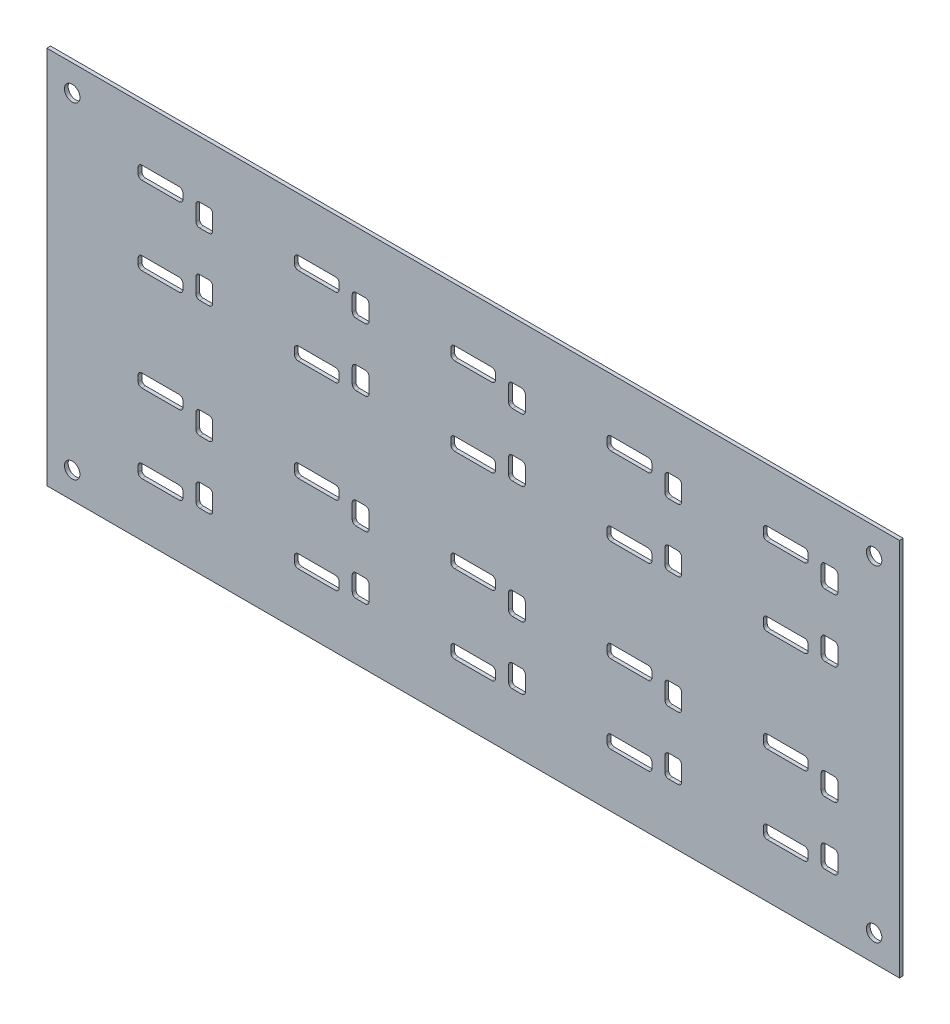
from build123d import *

# Parameters (mm, degrees)
SKETCH1_W                  = 457.2
SKETCH1_H                  = 203.2
BOSS_EXTRUDE1_DEPTH        = 2
SKETCH2_W                  = 24
SKETCH2_H                  = 7
CUT_EXTRUDE1_DEPTH         = 251.16898289
LPATTERN1_COUNT            = 2
LPATTERN1_PITCH            = 42.02811
LPATTERN2_COUNT            = 5
LPATTERN2_PITCH            = 83.82
LPATTERN2_COUNT_DIR2       = 2
LPATTERN2_PITCH_DIR2       = 96.52
LPATTERN2_COPY_1_SKETCH_W  = 24
LPATTERN2_COPY_1_SKETCH_H  = 7
LPATTERN2_COPY_1_DEPTH     = 251.16898289
LPATTERN2_COPY_2_SKETCH_W  = 24
LPATTERN2_COPY_2_SKETCH_H  = 7
LPATTERN2_COPY_2_DEPTH     = 251.16898289
LPATTERN2_COPY_3_SKETCH_W  = 24
LPATTERN2_COPY_3_SKETCH_H  = 7
LPATTERN2_COPY_3_DEPTH     = 251.16898289
LPATTERN2_COPY_4_SKETCH_W  = 24
LPATTERN2_COPY_4_SKETCH_H  = 7
LPATTERN2_COPY_4_DEPTH     = 251.16898289
LPATTERN2_COPY_5_SKETCH_W  = 24
LPATTERN2_COPY_5_SKETCH_H  = 7
LPATTERN2_COPY_5_DEPTH     = 251.16898289
LPATTERN2_COPY_6_SKETCH_W  = 24
LPATTERN2_COPY_6_SKETCH_H  = 7
LPATTERN2_COPY_6_DEPTH     = 251.16898289
LPATTERN2_COPY_7_SKETCH_W  = 24
LPATTERN2_COPY_7_SKETCH_H  = 7
LPATTERN2_COPY_7_DEPTH     = 251.16898289
LPATTERN2_COPY_8_SKETCH_W  = 24
LPATTERN2_COPY_8_SKETCH_H  = 7
LPATTERN2_COPY_8_DEPTH     = 251.16898289
LPATTERN2_COPY_9_SKETCH_W  = 24
LPATTERN2_COPY_9_SKETCH_H  = 7
LPATTERN2_COPY_9_DEPTH     = 251.16898289
FILLET1_R                  = 2
F_8_3_8_3_DIAMETER_HOLE1_D = 8.3
SKETCH5_W                  = 9
SKETCH5_H                  = 12
CUT_EXTRUDE2_DEPTH         = 251.16898289
FILLET2_R                  = 2
LPATTERN3_COUNT            = 5
LPATTERN3_PITCH            = 83.82
LPATTERN3_COUNT_DIR2       = 2
LPATTERN3_PITCH_DIR2       = 96.52
FILLET2_OF_LPATTERN3_R     = 2


with BuildPart() as part:
    # Sketch1 → Boss-Extrude1 (new body)
    with BuildSketch(Plane.XY):
        Rectangle(SKETCH1_W, SKETCH1_H)
    extrude(amount=BOSS_EXTRUDE1_DEPTH)

    # Sketch2 → Cut-Extrude1 (cut, through all)
    with BuildSketch(Plane(origin=(0, 0, 0), x_dir=(-1, 0, 0), z_dir=(0, 0, -1))):
        with Locations((167.6273, -69.27342)):
            Rectangle(SKETCH2_W, SKETCH2_H)
    cut_extrude1 = extrude(amount=-CUT_EXTRUDE1_DEPTH, mode=Mode.SUBTRACT)

    # LPattern1: Cut-Extrude1 ×2
    with Locations(*[(0, i * LPATTERN1_PITCH, 0) for i in range(1, LPATTERN1_COUNT)]):
        add(cut_extrude1, mode=Mode.SUBTRACT)

    # LPattern2: Cut-Extrude1 5 × 2
    with Locations(*[(i * LPATTERN2_PITCH, j * LPATTERN2_PITCH_DIR2, 0) for i in range(LPATTERN2_COUNT) for j in range(LPATTERN2_COUNT_DIR2) if (i, j) != (0, 0)]):
        add(cut_extrude1, mode=Mode.SUBTRACT)

    # LPattern2 copy 1 sketch → LPattern2 copy 1 (cut, through all)
    with BuildSketch(Plane(origin=(0, 138.54811, 0), x_dir=(-1, 0, 0), z_dir=(0, 0, -1))):
        with Locations((167.6273, -69.27342)):
            Rectangle(LPATTERN2_COPY_1_SKETCH_W, LPATTERN2_COPY_1_SKETCH_H)
    extrude(amount=-LPATTERN2_COPY_1_DEPTH, mode=Mode.SUBTRACT)

    # LPattern2 copy 2 sketch → LPattern2 copy 2 (cut, through all)
    with BuildSketch(Plane(origin=(83.82, 42.02811, 0), x_dir=(-1, 0, 0), z_dir=(0, 0, -1))):
        with Locations((167.6273, -69.27342)):
            Rectangle(LPATTERN2_COPY_2_SKETCH_W, LPATTERN2_COPY_2_SKETCH_H)
    extrude(amount=-LPATTERN2_COPY_2_DEPTH, mode=Mode.SUBTRACT)

    # LPattern2 copy 3 sketch → LPattern2 copy 3 (cut, through all)
    with BuildSketch(Plane(origin=(83.82, 138.54811, 0), x_dir=(-1, 0, 0), z_dir=(0, 0, -1))):
        with Locations((167.6273, -69.27342)):
            Rectangle(LPATTERN2_COPY_3_SKETCH_W, LPATTERN2_COPY_3_SKETCH_H)
    extrude(amount=-LPATTERN2_COPY_3_DEPTH, mode=Mode.SUBTRACT)

    # LPattern2 copy 4 sketch → LPattern2 copy 4 (cut, through all)
    with BuildSketch(Plane(origin=(167.64, 42.02811, 0), x_dir=(-1, 0, 0), z_dir=(0, 0, -1))):
        with Locations((167.6273, -69.27342)):
            Rectangle(LPATTERN2_COPY_4_SKETCH_W, LPATTERN2_COPY_4_SKETCH_H)
    extrude(amount=-LPATTERN2_COPY_4_DEPTH, mode=Mode.SUBTRACT)

    # LPattern2 copy 5 sketch → LPattern2 copy 5 (cut, through all)
    with BuildSketch(Plane(origin=(167.64, 138.54811, 0), x_dir=(-1, 0, 0), z_dir=(0, 0, -1))):
        with Locations((167.6273, -69.27342)):
            Rectangle(LPATTERN2_COPY_5_SKETCH_W, LPATTERN2_COPY_5_SKETCH_H)
    extrude(amount=-LPATTERN2_COPY_5_DEPTH, mode=Mode.SUBTRACT)

    # LPattern2 copy 6 sketch → LPattern2 copy 6 (cut, through all)
    with BuildSketch(Plane(origin=(251.46, 42.02811, 0), x_dir=(-1, 0, 0), z_dir=(0, 0, -1))):
        with Locations((167.6273, -69.27342)):
            Rectangle(LPATTERN2_COPY_6_SKETCH_W, LPATTERN2_COPY_6_SKETCH_H)
    extrude(amount=-LPATTERN2_COPY_6_DEPTH, mode=Mode.SUBTRACT)

    # LPattern2 copy 7 sketch → LPattern2 copy 7 (cut, through all)
    with BuildSketch(Plane(origin=(251.46, 138.54811, 0), x_dir=(-1, 0, 0), z_dir=(0, 0, -1))):
        with Locations((167.6273, -69.27342)):
            Rectangle(LPATTERN2_COPY_7_SKETCH_W, LPATTERN2_COPY_7_SKETCH_H)
    extrude(amount=-LPATTERN2_COPY_7_DEPTH, mode=Mode.SUBTRACT)

    # LPattern2 copy 8 sketch → LPattern2 copy 8 (cut, through all)
    with BuildSketch(Plane(origin=(335.28, 42.02811, 0), x_dir=(-1, 0, 0), z_dir=(0, 0, -1))):
        with Locations((167.6273, -69.27342)):
            Rectangle(LPATTERN2_COPY_8_SKETCH_W, LPATTERN2_COPY_8_SKETCH_H)
    extrude(amount=-LPATTERN2_COPY_8_DEPTH, mode=Mode.SUBTRACT)

    # LPattern2 copy 9 sketch → LPattern2 copy 9 (cut, through all)
    with BuildSketch(Plane(origin=(335.28, 138.54811, 0), x_dir=(-1, 0, 0), z_dir=(0, 0, -1))):
        with Locations((167.6273, -69.27342)):
            Rectangle(LPATTERN2_COPY_9_SKETCH_W, LPATTERN2_COPY_9_SKETCH_H)
    extrude(amount=-LPATTERN2_COPY_9_DEPTH, mode=Mode.SUBTRACT)

    # Fillet1
    fillet1_edges = [part.edges().sort_by_distance(p)[0] for p in [
        (-95.8073, 30.74658, 1),
        (-95.8073, 23.74658, 1),
        (-71.8073, 23.74658, 1),
        (-71.8073, 30.74658, 1),
        (-95.8073, 72.77469, 1),
        (-95.8073, 65.77469, 1),
        (-71.8073, 65.77469, 1),
        (-71.8073, 72.77469, 1),
        (-11.9873, -65.77342, 1),
        (-11.9873, -72.77342, 1),
        (12.0127, -72.77342, 1),
        (12.0127, -65.77342, 1),
        (-11.9873, -23.74531, 1),
        (-11.9873, -30.74531, 1),
        (12.0127, -30.74531, 1),
        (12.0127, -23.74531, 1),
        (-11.9873, 30.74658, 1),
        (-11.9873, 23.74658, 1),
        (12.0127, 23.74658, 1),
        (12.0127, 30.74658, 1),
        (-11.9873, 72.77469, 1),
        (-11.9873, 65.77469, 1),
        (12.0127, 65.77469, 1),
        (12.0127, 72.77469, 1),
        (71.8327, -65.77342, 1),
        (71.8327, -72.77342, 1),
        (95.8327, -72.77342, 1),
        (95.8327, -65.77342, 1),
        (-179.6273, -65.77342, 1),
        (71.8327, -23.74531, 1),
        (71.8327, -30.74531, 1),
        (95.8327, -30.74531, 1),
        (95.8327, -23.74531, 1),
        (-179.6273, -72.77342, 1),
        (-155.6273, -72.77342, 1),
        (-155.6273, -65.77342, 1),
        (71.8327, 30.74658, 1),
        (71.8327, 23.74658, 1),
        (95.8327, 23.74658, 1),
        (95.8327, 30.74658, 1),
        (71.8327, 72.77469, 1),
        (71.8327, 65.77469, 1),
        (95.8327, 65.77469, 1),
        (95.8327, 72.77469, 1),
        (155.6527, -65.77342, 1),
        (155.6527, -72.77342, 1),
        (179.6527, -72.77342, 1),
        (179.6527, -65.77342, 1),
        (155.6527, -23.74531, 1),
        (155.6527, -30.74531, 1),
        (179.6527, -30.74531, 1),
        (179.6527, -23.74531, 1),
        (155.6527, 30.74658, 1),
        (155.6527, 23.74658, 1),
        (179.6527, 23.74658, 1),
        (179.6527, 30.74658, 1),
        (155.6527, 72.77469, 1),
        (155.6527, 65.77469, 1),
        (179.6527, 65.77469, 1),
        (179.6527, 72.77469, 1),
        (-179.6273, -23.74531, 1),
        (-179.6273, -30.74531, 1),
        (-155.6273, -30.74531, 1),
        (-155.6273, -23.74531, 1),
        (-179.6273, 30.74658, 1),
        (-179.6273, 23.74658, 1),
        (-155.6273, 23.74658, 1),
        (-155.6273, 30.74658, 1),
        (-179.6273, 72.77469, 1),
        (-179.6273, 65.77469, 1),
        (-155.6273, 65.77469, 1),
        (-155.6273, 72.77469, 1),
        (-95.8073, -65.77342, 1),
        (-95.8073, -72.77342, 1),
        (-71.8073, -72.77342, 1),
        (-71.8073, -65.77342, 1),
        (-95.8073, -23.74531, 1),
        (-95.8073, -30.74531, 1),
        (-71.8073, -30.74531, 1),
        (-71.8073, -23.74531, 1),
    ]]
    fillet(fillet1_edges, radius=FILLET1_R)

    # Ø8.3 (8.3) Diameter Hole1 (through all)
    with Locations(Plane(origin=(0, 0, 0), x_dir=(-1, 0, 0), z_dir=(0, 0, -1))):
        with Locations((-215.000000022, 87.500000006), (-215.000000022, -87.499999994), (214.999999978, -87.499999994), (214.999999978, 87.500000006)):
            Hole(F_8_3_8_3_DIAMETER_HOLE1_D / 2)

    # Sketch5 → Cut-Extrude2 (cut, through all)
    with BuildSketch(Plane(origin=(0, 0, 0), x_dir=(-1, 0, 0), z_dir=(0, 0, -1))):
        with Locations((-191.135, 65.0748)):
            Rectangle(SKETCH5_W, SKETCH5_H)
        with Locations((-191.135, 31.4452)):
            Rectangle(SKETCH5_W, SKETCH5_H)
    cut_extrude2 = extrude(amount=-CUT_EXTRUDE2_DEPTH, mode=Mode.SUBTRACT)

    # Fillet2
    fillet2_edges = [part.edges().sort_by_distance(p)[0] for p in [
        (195.635, 59.0748, 1),
        (195.635, 71.0748, 1),
        (186.635, 71.0748, 1),
        (186.635, 59.0748, 1),
        (195.635, 25.4452, 1),
        (195.635, 37.4452, 1),
        (186.635, 37.4452, 1),
        (186.635, 25.4452, 1),
    ]]
    fillet(fillet2_edges, radius=FILLET2_R)

    # LPattern3: Cut-Extrude2 5 × 2
    with Locations(*[(-i * LPATTERN3_PITCH, -j * LPATTERN3_PITCH_DIR2, 0) for i in range(LPATTERN3_COUNT) for j in range(LPATTERN3_COUNT_DIR2) if (i, j) != (0, 0)]):
        add(cut_extrude2, mode=Mode.SUBTRACT)

    # Fillet2 of LPattern3
    fillet2_of_lpattern3_edges = [part.edges().sort_by_distance(p)[0] for p in [
        (195.635, -37.4452, 1),
        (195.635, -25.4452, 1),
        (186.635, -25.4452, 1),
        (186.635, -37.4452, 1),
        (195.635, -71.0748, 1),
        (195.635, -59.0748, 1),
        (186.635, -59.0748, 1),
        (186.635, -71.0748, 1),
        (111.815, 59.0748, 1),
        (111.815, 71.0748, 1),
        (102.815, 71.0748, 1),
        (102.815, 59.0748, 1),
        (111.815, 25.4452, 1),
        (111.815, 37.4452, 1),
        (102.815, 37.4452, 1),
        (102.815, 25.4452, 1),
        (111.815, -37.4452, 1),
        (111.815, -25.4452, 1),
        (102.815, -25.4452, 1),
        (102.815, -37.4452, 1),
        (111.815, -71.0748, 1),
        (111.815, -59.0748, 1),
        (102.815, -59.0748, 1),
        (102.815, -71.0748, 1),
        (27.995, 59.0748, 1),
        (27.995, 71.0748, 1),
        (18.995, 71.0748, 1),
        (18.995, 59.0748, 1),
        (27.995, 25.4452, 1),
        (27.995, 37.4452, 1),
        (18.995, 37.4452, 1),
        (18.995, 25.4452, 1),
        (27.995, -37.4452, 1),
        (27.995, -25.4452, 1),
        (18.995, -25.4452, 1),
        (18.995, -37.4452, 1),
        (27.995, -71.0748, 1),
        (27.995, -59.0748, 1),
        (18.995, -59.0748, 1),
        (18.995, -71.0748, 1),
        (-55.825, 59.0748, 1),
        (-55.825, 71.0748, 1),
        (-64.825, 71.0748, 1),
        (-64.825, 59.0748, 1),
        (-55.825, 25.4452, 1),
        (-55.825, 37.4452, 1),
        (-64.825, 37.4452, 1),
        (-64.825, 25.4452, 1),
        (-55.825, -37.4452, 1),
        (-55.825, -25.4452, 1),
        (-64.825, -25.4452, 1),
        (-64.825, -37.4452, 1),
        (-55.825, -71.0748, 1),
        (-55.825, -59.0748, 1),
        (-64.825, -59.0748, 1),
        (-64.825, -71.0748, 1),
        (-139.645, 59.0748, 1),
        (-139.645, 71.0748, 1),
        (-148.645, 71.0748, 1),
        (-148.645, 59.0748, 1),
        (-139.645, 25.4452, 1),
        (-139.645, 37.4452, 1),
        (-148.645, 37.4452, 1),
        (-148.645, 25.4452, 1),
        (-139.645, -37.4452, 1),
        (-139.645, -25.4452, 1),
        (-148.645, -25.4452, 1),
        (-148.645, -37.4452, 1),
        (-139.645, -71.0748, 1),
        (-139.645, -59.0748, 1),
        (-148.645, -59.0748, 1),
        (-148.645, -71.0748, 1),
    ]]
    fillet(fillet2_of_lpattern3_edges, radius=FILLET2_OF_LPATTERN3_R)


solid = part.part
